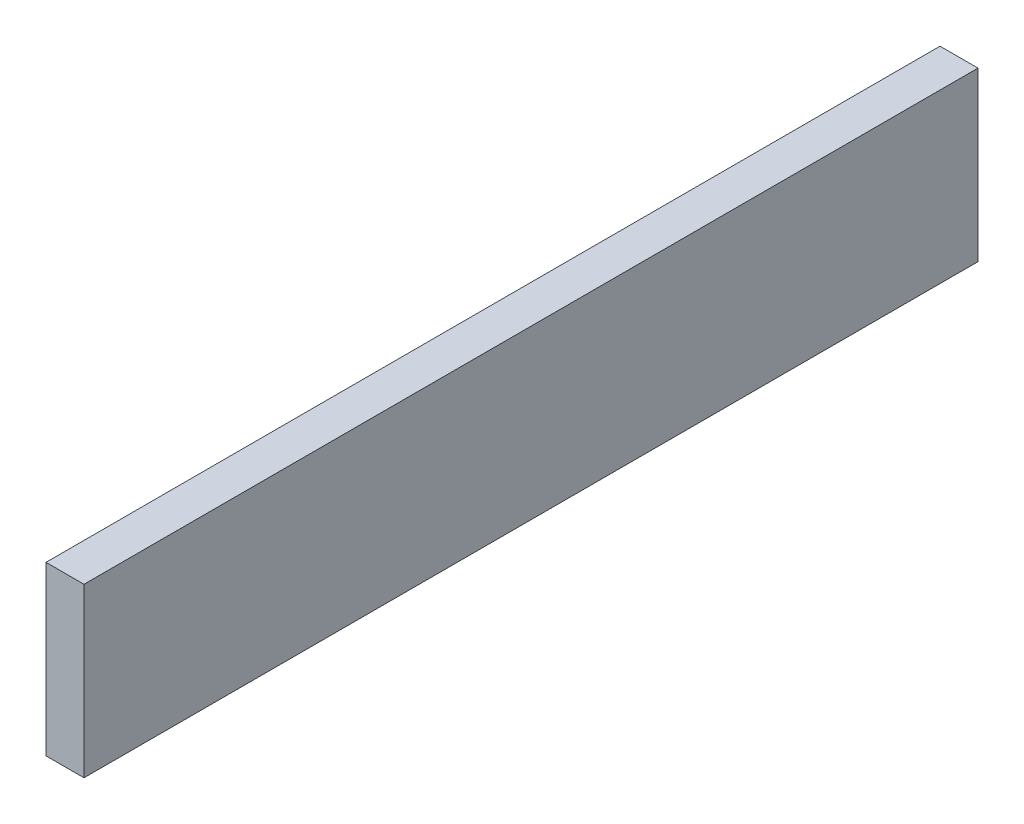
from build123d import *

# Parameters (mm, degrees)
SKETCH1_W           = 3.4
SKETCH1_H           = 80
BOSS_EXTRUDE1_DEPTH = 15


with BuildPart() as part:
    # Sketch1 → Boss-Extrude1 (new body)
    with BuildSketch(Plane(origin=(0, 0, 0), x_dir=(1, 0, 0), z_dir=(0, 1, 0))):
        with Locations((1.7, 40)):
            Rectangle(SKETCH1_W, SKETCH1_H)
    extrude(amount=BOSS_EXTRUDE1_DEPTH)


solid = part.part
